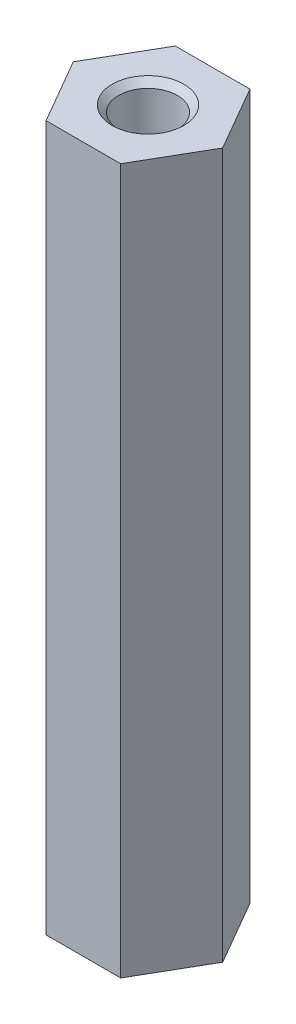
from build123d import *

# Parameters (mm, degrees)
EXTRUDE_1_DEPTH             = 30
M3_TAPPED_HOLE1_D           = 2.5
M3_TAPPED_HOLE1_DEPTH       = 10
M3_TAPPED_HOLE1_CSINK_D     = 3.05
M3_TAPPED_HOLE1_CSINK_ANGLE = 90
M3_TAPPED_HOLE1_TIP         = 0.751075774
M3_TAPPED_HOLE2_D           = 2.5
M3_TAPPED_HOLE2_DEPTH       = 10
M3_TAPPED_HOLE2_CSINK_D     = 3.05
M3_TAPPED_HOLE2_CSINK_ANGLE = 90
M3_TAPPED_HOLE2_TIP         = 0.751075774


with BuildPart() as part:
    # 草图1 → 凸台-拉伸1 (new body)
    with BuildSketch(Plane(origin=(0, 0, 0), x_dir=(1, 0, 0), z_dir=(0, 1, 0))):
        Polygon((3.175426481, 0), (1.58771324, 2.75), (-1.58771324, 2.75), (-3.175426481, 0), (-1.58771324, -2.75), (1.58771324, -2.75), align=None)
    extrude(amount=EXTRUDE_1_DEPTH)

    # M3 Tapped Hole1
    with Locations(Plane(origin=(0, 30, 0), x_dir=(1, 0, 0), z_dir=(0, 1, 0))):
        with Locations((0, 0)):
            CounterSinkHole(M3_TAPPED_HOLE1_D / 2, M3_TAPPED_HOLE1_CSINK_D / 2, depth=M3_TAPPED_HOLE1_DEPTH, counter_sink_angle=M3_TAPPED_HOLE1_CSINK_ANGLE)
            with Locations((0, 0, -(M3_TAPPED_HOLE1_DEPTH + M3_TAPPED_HOLE1_TIP / 2))):  # 118° drill point
                Cone(0, M3_TAPPED_HOLE1_D / 2, M3_TAPPED_HOLE1_TIP, mode=Mode.SUBTRACT)

    # M3 Tapped Hole2
    with Locations(Plane(origin=(0, 0, 0), x_dir=(-1, 0, 0), z_dir=(0, -1, 0))):
        with Locations((0, 0)):
            CounterSinkHole(M3_TAPPED_HOLE2_D / 2, M3_TAPPED_HOLE2_CSINK_D / 2, depth=M3_TAPPED_HOLE2_DEPTH, counter_sink_angle=M3_TAPPED_HOLE2_CSINK_ANGLE)
            with Locations((0, 0, -(M3_TAPPED_HOLE2_DEPTH + M3_TAPPED_HOLE2_TIP / 2))):  # 118° drill point
                Cone(0, M3_TAPPED_HOLE2_D / 2, M3_TAPPED_HOLE2_TIP, mode=Mode.SUBTRACT)


solid = part.part
